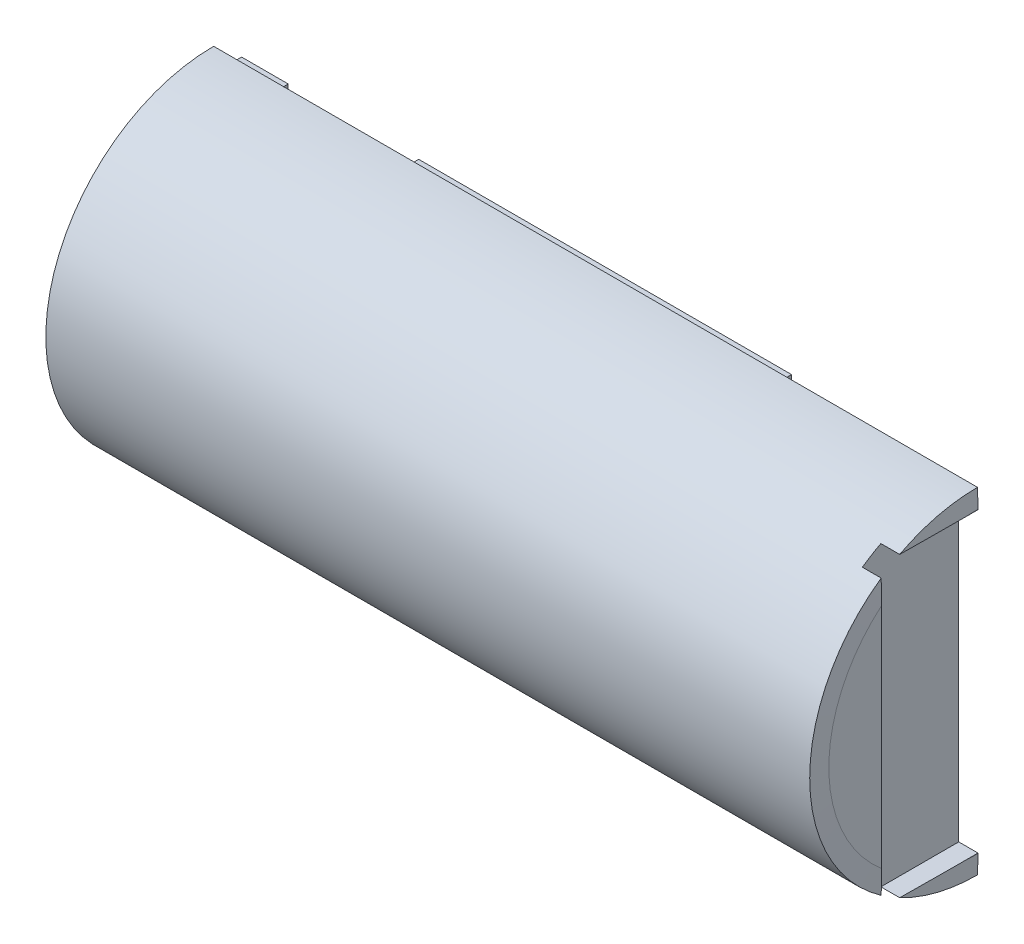
from build123d import *

# Parameters (mm, degrees)
REVOLVE2_ANGLE           = 180
SKETCH5_W                = 2.54
SKETCH5_H                = 12.7
SKETCH5_W_2              = 101.6
SKETCH5_H_2              = 2.54
SKETCH5_W_3              = 12.7
BOSS_EXTRUDE1_DEPTH      = 2.54
SKETCH7_W                = 20
SKETCH7_H                = 50
CUT_EXTRUDE1_DEPTH       = 7
BOSS_EXTRUDE3_REACH      = 220.035
SKETCH8_W                = 5
SKETCH8_H                = 91.44
SKETCH9_W                = 6.129296028
SKETCH9_H                = 8.078685473
BOSS_EXTRUDE4_DEPTH      = 2
BOSS_EXTRUDE7_START      = 8
BOSS_EXTRUDE7_DEPTH      = 8
BOSS_EXTRUDE8_REACH      = 220.035
BOSS_EXTRUDE8_END_RADIUS = 40.64
SKETCH13_W               = 75.08
SKETCH13_H               = 60.08
SKETCH13_W_2             = 70
SKETCH13_H_2             = 55
SKETCH14_W               = 75.08
SKETCH14_H               = 60.08
CUT_EXTRUDE3_DEPTH       = 11
BOSS_EXTRUDE9_REACH      = 217.997
SKETCH15_W               = 70
SKETCH15_H               = 55
CUT_EXTRUDE5_DEPTH       = 15
CUT_EXTRUDE6_REACH       = 202.84
SKETCH18_W               = 12
SKETCH18_H               = 56
BOSS_EXTRUDE10_REACH     = 220.035
SKETCH23_W               = 10
SKETCH23_H               = 81.28
SKETCH24_W               = 26.25
SKETCH24_H               = 81
CUT_EXTRUDE7_DEPTH       = 5.25


with BuildPart() as part:
    # Sketch2 → Revolve2 (revolve)
    with BuildSketch(Plane.XY):
        Polygon((0, 0), (0, 40.64), (0, 45.72), (25.4, 45.72), (195.4, 45.72), (208.1, 45.72), (208.22771659, 40.64), (195.52771659, 40.64), (25.4, 40.64), (5.08, 40.64), (5.08, 0), align=None)
    revolve(axis=Axis((0, 0, 0), (1, 0, 0)), revolution_arc=REVOLVE2_ANGLE)

    # Sketch5 → Boss-Extrude1 (add)
    with BuildSketch(Plane(origin=(0, 0, 0), x_dir=(-1, 0, 0), z_dir=(0, 0, -1))):
        with Locations((-2.54, 34.29)):
            Rectangle(SKETCH5_W, SKETCH5_H)
        with Locations((-104.113858295, -43.18)):
            Rectangle(SKETCH5_W_2, SKETCH5_H_2)
        with Locations((-11.43, 43.18)):
            Rectangle(SKETCH5_W_3, SKETCH5_H_2)
        with Locations((-104.113858295, 43.18)):
            Rectangle(SKETCH5_W_2, SKETCH5_H_2)
        with Locations((-11.43, -43.18)):
            Rectangle(SKETCH5_W_3, SKETCH5_H_2)
        with Locations((-2.54, -34.29)):
            Rectangle(SKETCH5_W, SKETCH5_H)
    extrude(amount=BOSS_EXTRUDE1_DEPTH)

    # Sketch7 → Cut-Extrude1 (cut)
    with BuildSketch(Plane.ZY):
        with Locations((10, 0)):
            Rectangle(SKETCH7_W, SKETCH7_H)
    extrude(amount=-CUT_EXTRUDE1_DEPTH, mode=Mode.SUBTRACT)

    # Sketch8 → Boss-Extrude3 (add, up to next)
    with BuildSketch(Plane(origin=(0, 0, 0), x_dir=(-1, 0, 0), z_dir=(0, 0, -1)), mode=Mode.PRIVATE) as boss_extrude3_sk1:
        with Locations((-15.58, 0)):
            Rectangle(SKETCH8_W, SKETCH8_H)
    boss_extrude3_tool1 = extrude(boss_extrude3_sk1.sketch, amount=-BOSS_EXTRUDE3_REACH, mode=Mode.PRIVATE) - part.part
    add(boss_extrude3_tool1.solids().sort_by_distance((15.58, 0, 0))[0])

    # Sketch9 → Boss-Extrude4 (add)
    with BuildSketch(Plane(origin=(5.08, 0, 0), x_dir=(0, 0, -1), z_dir=(1, 0, 0))):
        with Locations((-3.906446672, 33.952493663)):
            Rectangle(SKETCH9_W, SKETCH9_H)
    extrude(amount=BOSS_EXTRUDE4_DEPTH)

    # Sketch12 → Boss-Extrude7 (add)
    with BuildSketch(Plane.ZY.offset(-13.08).offset(BOSS_EXTRUDE7_START)):
        with BuildLine():
            Line((23.64, 33.056920607), (23.64, -33.056920607))
            ThreePointArc((23.64, -33.056920607), (40.64, 0), (23.64, 33.056920607))
        make_face()
    extrude(amount=-BOSS_EXTRUDE7_DEPTH)

    # Boss-Extrude8: up to this cylinder (the profile starts inside it)
    boss_extrude8_end = Plane(origin=(148.153858, 0, 0), z_dir=(-1, 0, 0)) * Cylinder(BOSS_EXTRUDE8_END_RADIUS, 522.35, mode=Mode.PRIVATE)
    # Sketch13 → Boss-Extrude8 (add, up to the surface)
    with BuildSketch(Plane(origin=(0, 0, 0), x_dir=(-1, 0, 0), z_dir=(0, 0, -1)), mode=Mode.PRIVATE) as boss_extrude8_sk1:
        with Locations((-148.153858295, 0)):
            Rectangle(SKETCH13_W, SKETCH13_H)
        with Locations((-148.153858295, 0)):
            Rectangle(SKETCH13_W_2, SKETCH13_H_2, mode=Mode.SUBTRACT)
    boss_extrude8_tool1 = extrude(boss_extrude8_sk1.sketch, amount=-BOSS_EXTRUDE8_REACH, mode=Mode.PRIVATE) & boss_extrude8_end
    add(boss_extrude8_tool1.solids().sort_by_distance((148.153858, 29.078407, 0))[0])

    # Sketch14 → Cut-Extrude3 (cut)
    with BuildSketch(Plane(origin=(0, 0, 0), x_dir=(-1, 0, 0), z_dir=(0, 0, -1))):
        with Locations((-148.153858295, 0)):
            Rectangle(SKETCH14_W, SKETCH14_H)
    extrude(amount=-CUT_EXTRUDE3_DEPTH, mode=Mode.SUBTRACT)

    # Sketch15 → Boss-Extrude9 (add, up to next)
    with BuildSketch(Plane(origin=(0, 0, 11), x_dir=(-1, 0, 0), z_dir=(0, 0, -1)), mode=Mode.PRIVATE) as boss_extrude9_sk1:
        with Locations((-148.153858295, 0)):
            Rectangle(SKETCH15_W, SKETCH15_H)
    boss_extrude9_tool1 = extrude(boss_extrude9_sk1.sketch, amount=-BOSS_EXTRUDE9_REACH, mode=Mode.PRIVATE) - part.part
    add(boss_extrude9_tool1.solids().sort_by_distance((148.153858, 0, 11))[0])

    # Sketch17 → Cut-Extrude5 (cut)
    with BuildSketch(Plane(origin=(0, 0, 11), x_dir=(-1, 0, 0), z_dir=(0, 0, -1))):
        Polygon((-113.153858295, 27.5), (-183.153858295, 27.5), (-183.153858295, 19.5), (-185.693858295, 19.5), (-185.693858295, 5.5), (-183.153858295, 5.5), (-183.153858295, -13.5), (-185.693858295, -13.5), (-185.693858295, -24.5), (-183.153858295, -24.5), (-183.153858295, -27.5), (-113.153858295, -27.5), align=None)
    extrude(amount=-CUT_EXTRUDE5_DEPTH, mode=Mode.SUBTRACT)

    # Sketch18 → Cut-Extrude6 (cut, up to next)
    with BuildSketch(Plane(origin=(18.08, 0, 0), x_dir=(0, 0, -1), z_dir=(1, 0, 0)), mode=Mode.PRIVATE) as cut_extrude6_sk1:
        with Locations((-6, -10.004795356)):
            Rectangle(SKETCH18_W, SKETCH18_H)
    cut_extrude6_tool1 = extrude(cut_extrude6_sk1.sketch, amount=-CUT_EXTRUDE6_REACH, mode=Mode.PRIVATE) & part.part
    add(cut_extrude6_tool1.solids().sort_by_distance((18.08, -10.004795, 6))[0], mode=Mode.SUBTRACT)

    # Sketch23 → Boss-Extrude10 (add, up to next)
    with BuildSketch(Plane(origin=(0, 0, 0), x_dir=(-1, 0, 0), z_dir=(0, 0, -1)), mode=Mode.PRIVATE) as boss_extrude10_sk1:
        with Locations((-203.22771659, 0)):
            Rectangle(SKETCH23_W, SKETCH23_H)
    boss_extrude10_tool1 = extrude(boss_extrude10_sk1.sketch, amount=-BOSS_EXTRUDE10_REACH, mode=Mode.PRIVATE) - part.part
    add(boss_extrude10_tool1.solids().sort_by_distance((203.227717, 0, 0))[0])

    # Sketch24 → Cut-Extrude7 (cut)
    with BuildSketch(Plane(origin=(208.22771659, 0, 0), x_dir=(0, 0, -1), z_dir=(1, 0, 0))):
        with Locations((-13.125, 0)):
            Rectangle(SKETCH24_W, SKETCH24_H)
    extrude(amount=-CUT_EXTRUDE7_DEPTH, mode=Mode.SUBTRACT)


solid = part.part
